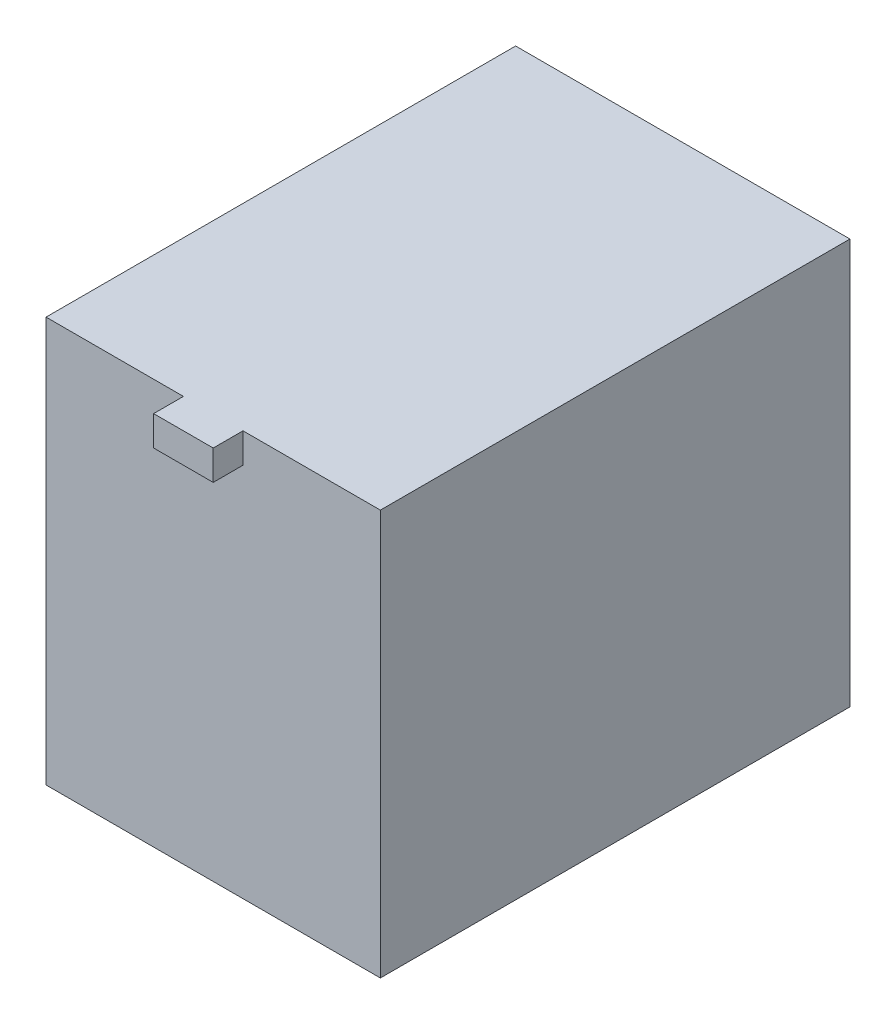
from build123d import *

# Parameters (mm, degrees)
SKETCH_1_W      = 56.1
SKETCH_1_H      = 78.8
EXTRUDE_1_DEPTH = 68
SKETCH_2_W      = 5
SKETCH_2_H      = 5
EXTRUDE_2_DEPTH = 5


with BuildPart() as part:
    # 草图1 → 凸台-拉伸1 (new body)
    with BuildSketch(Plane(origin=(0, 0, 0), x_dir=(1, 0, 0), z_dir=(0, 1, 0))):
        Rectangle(SKETCH_1_W, SKETCH_1_H)
    extrude(amount=EXTRUDE_1_DEPTH)

    # 草图2 → 凸台-拉伸2 (add)
    with BuildSketch(Plane.XY.offset(39.4)):
        with Locations((-2.5, 65.5)):
            Rectangle(SKETCH_2_W, SKETCH_2_H)
        with Locations((2.5, 65.5)):
            Rectangle(SKETCH_2_W, SKETCH_2_H)
    extrude(amount=EXTRUDE_2_DEPTH)


solid = part.part
